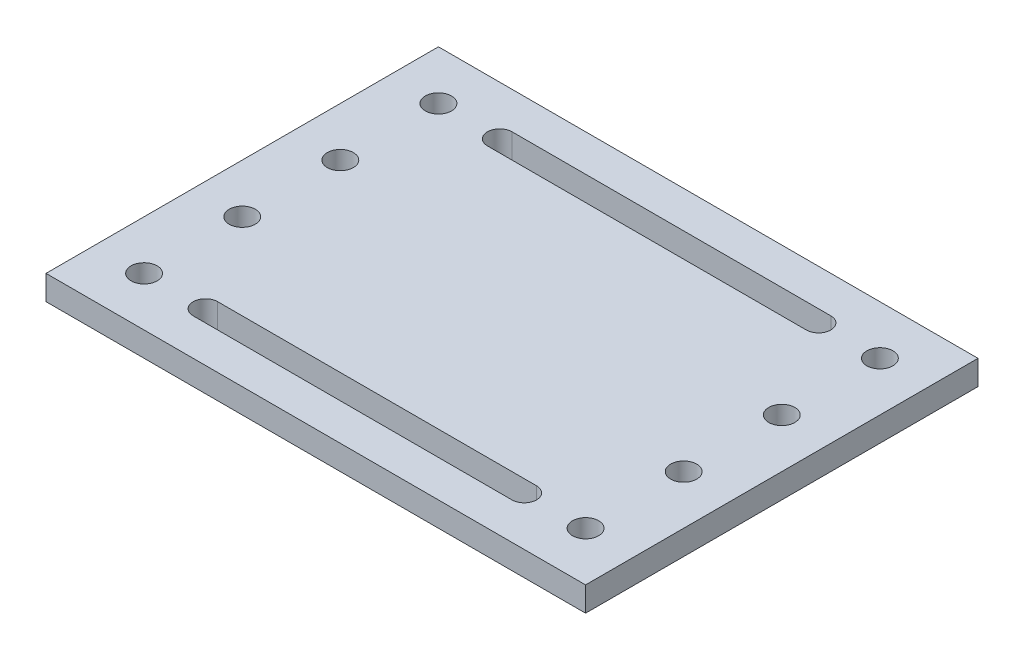
from build123d import *

# Parameters (mm, degrees)
SKETCH1_W               = 457.2
SKETCH1_H               = 101.6
BOSS_EXTRUDE1_DEPTH     = 6.35
CUT_EXTRUDE1_DEPTH      = 235.26250767
F_1_4_CLEARANCE_HOLE1_D = 6.7564
MIRROR4_COPY_1_D        = 6.7564
CUT_EXTRUDE2_DEPTH      = 235.26250767
SKETCH7_W               = 317.5
SKETCH7_H               = 101.6
CUT_EXTRUDE3_DEPTH      = 235.26250767
F_1_4_CLEARANCE_HOLE2_D = 6.7564


with BuildPart() as part:
    # Sketch1 → Boss-Extrude1 (new body)
    with BuildSketch(Plane(origin=(0, 0, 0), x_dir=(1, 0, 0), z_dir=(0, 1, 0))):
        Rectangle(SKETCH1_W, SKETCH1_H)
    extrude(amount=BOSS_EXTRUDE1_DEPTH)

    # Sketch2 → Cut-Extrude1 (cut, through all)
    with BuildSketch(Plane(origin=(0, 6.35, 0), x_dir=(1, 0, 0), z_dir=(0, 1, 0))):
        with BuildLine():
            Line((200.025, -41.275), (117.475, -41.275))
            ThreePointArc((117.475, -41.275), (114.3, -38.1), (117.475, -34.925))
            Line((117.475, -34.925), (200.025, -34.925))
            ThreePointArc((200.025, -34.925), (203.2, -38.1), (200.025, -41.275))
        make_face()
    cut_extrude1 = extrude(amount=-CUT_EXTRUDE1_DEPTH, mode=Mode.SUBTRACT)

    # Mirror1: Cut-Extrude1 across plane
    add(cut_extrude1.mirror(Plane.XY), mode=Mode.SUBTRACT)

    # 1/4 Clearance Hole1 (through all)
    with Locations(Plane(origin=(0, 6.35, 0), x_dir=(1, 0, 0), z_dir=(0, 1, 0))):
        with Locations((-215.9, 12.7), (-215.9, 38.1)):
            f_1_4_clearance_hole1 = Hole(F_1_4_CLEARANCE_HOLE1_D / 2)

    # Mirror3: 1/4 Clearance Hole1 across plane
    add(f_1_4_clearance_hole1.mirror(Plane.XY), mode=Mode.SUBTRACT)

    # Mirror4: 1/4 Clearance Hole1 across plane
    add(f_1_4_clearance_hole1.mirror(Plane(origin=(0, 0, 0), x_dir=(0, 0, 1), z_dir=(1, 0, 0))), mode=Mode.SUBTRACT)

    # Mirror4 copy 1 (through all)
    with Locations(Plane(origin=(0, 6.35, 0), x_dir=(-1, 0, 0), z_dir=(0, 1, 0))):
        with Locations((-215.9, 12.7), (-215.9, 38.1)):
            Hole(MIRROR4_COPY_1_D / 2)

    # Sketch6 → Cut-Extrude2 (cut, through all)
    with BuildSketch(Plane(origin=(0, 6.35, 0), x_dir=(1, 0, 0), z_dir=(0, 1, 0))):
        with BuildLine():
            Line((-190.5, 41.275), (-63.5, 41.275))
            ThreePointArc((-63.5, 41.275), (-60.325, 38.1), (-63.5, 34.925))
            Line((-63.5, 34.925), (-190.5, 34.925))
            ThreePointArc((-190.5, 34.925), (-193.675, 38.1), (-190.5, 41.275))
        make_face()
    cut_extrude2 = extrude(amount=-CUT_EXTRUDE2_DEPTH, mode=Mode.SUBTRACT)

    # Mirror5: Cut-Extrude2 across plane
    add(cut_extrude2.mirror(Plane.XY), mode=Mode.SUBTRACT)

    # Sketch7 → Cut-Extrude3 (cut, through all)
    with BuildSketch(Plane(origin=(0, 6.35, 0), x_dir=(1, 0, 0), z_dir=(0, 1, 0))):
        with Locations((-69.85, 0)):
            Rectangle(SKETCH7_W, SKETCH7_H)
    extrude(amount=-CUT_EXTRUDE3_DEPTH, mode=Mode.SUBTRACT)

    # 1/4 Clearance Hole2 (through all)
    with Locations(Plane(origin=(0, 6.35, 0), x_dir=(1, 0, 0), z_dir=(0, 1, 0))):
        with Locations((101.6, 38.1), (101.6, 12.7)):
            f_1_4_clearance_hole2 = Hole(F_1_4_CLEARANCE_HOLE2_D / 2)

    # Mirror8: 1/4 Clearance Hole2 across plane
    add(f_1_4_clearance_hole2.mirror(Plane.XY), mode=Mode.SUBTRACT)


solid = part.part
